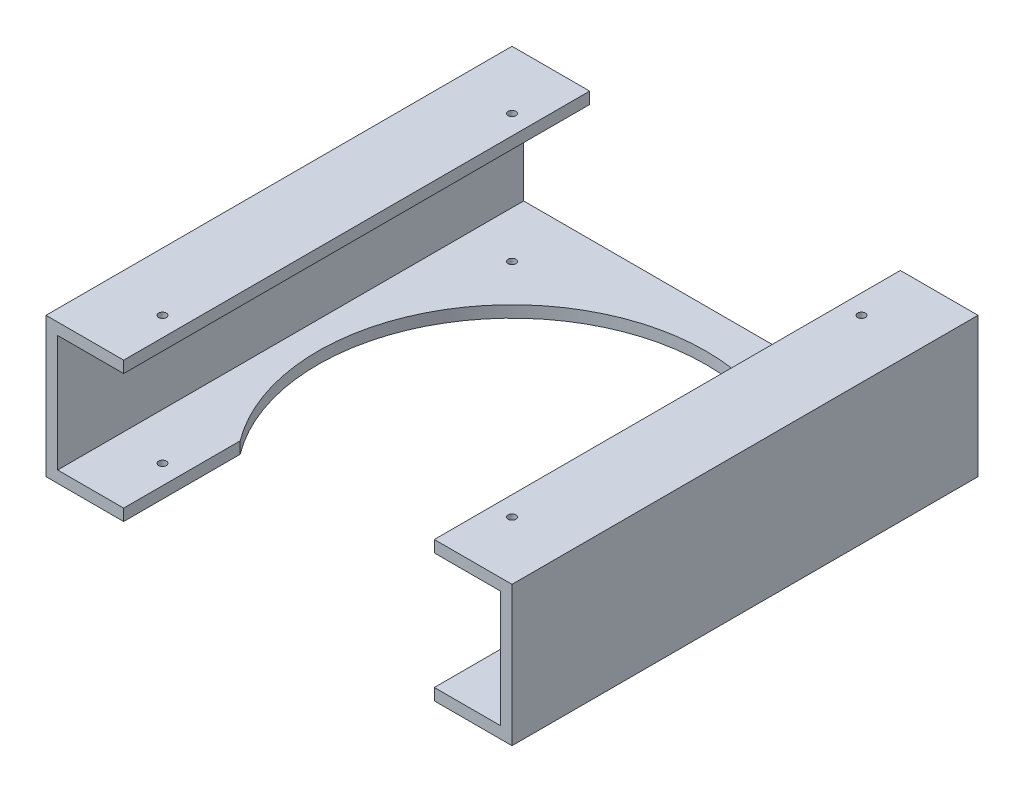
from build123d import *

# Parameters (mm, degrees)
BOSS_EXTRUDE1_DEPTH      = 60
BOSS_EXTRUDE1_DEPTH_BACK = 60
SKETCH1_W                = 120
SKETCH1_H                = 36
SKETCH2_W                = 114
SKETCH2_H                = 30
CUT_EXTRUDE1_DEPTH       = 136.366170072
SKETCH3_W                = 80
SKETCH3_H                = 22.357813814
CUT_EXTRUDE2_DEPTH       = 136.366170072
SKETCH4_R                = 50
CUT_EXTRUDE3_DEPTH       = 92.043945433
SKETCH7_R                = 1
CUT_EXTRUDE4_DEPTH       = 93.173748974
CUT_EXTRUDE6_REACH       = 94.174
SKETCH9_W                = 80
SKETCH9_H                = 60


with BuildPart() as part:
    # Sketch1 → Boss-Extrude1 (new, two sides: drawn at the far end of the back side and taken through both)
    with BuildSketch(Plane.XY.offset(-BOSS_EXTRUDE1_DEPTH_BACK)):
        Rectangle(SKETCH1_W, SKETCH1_H)
    extrude(amount=BOSS_EXTRUDE1_DEPTH + BOSS_EXTRUDE1_DEPTH_BACK)

    # Sketch2 → Cut-Extrude1 (cut, through all)
    with BuildSketch(Plane.XY.offset(60)):
        Rectangle(SKETCH2_W, SKETCH2_H)
    extrude(amount=-CUT_EXTRUDE1_DEPTH, mode=Mode.SUBTRACT)

    # Sketch3 → Cut-Extrude2 (cut, through all)
    with BuildSketch(Plane.XY.offset(60)):
        with Locations((0, 15)):
            Rectangle(SKETCH3_W, SKETCH3_H)
    extrude(amount=-CUT_EXTRUDE2_DEPTH, mode=Mode.SUBTRACT)

    # Sketch4 → Cut-Extrude3 (cut, through all)
    with BuildSketch(Plane(origin=(0, -15, 0), x_dir=(1, 0, 0), z_dir=(0, 1, 0))):
        Circle(SKETCH4_R)
    extrude(amount=-CUT_EXTRUDE3_DEPTH, mode=Mode.SUBTRACT)

    # Sketch7 → Cut-Extrude4 (cut, through all)
    with BuildSketch(Plane(origin=(0, -18, 0), x_dir=(-1, 0, 0), z_dir=(0, -1, 0))):
        with Locations((45, -45)):
            Circle(SKETCH7_R)
        with Locations((-45, -45)):
            Circle(SKETCH7_R)
        with Locations((-45, 45)):
            Circle(SKETCH7_R)
        with Locations((45, 45)):
            Circle(SKETCH7_R)
    extrude(amount=-CUT_EXTRUDE4_DEPTH, mode=Mode.SUBTRACT)

    # Sketch9 → Cut-Extrude6 (cut, up to next)
    with BuildSketch(Plane.XZ.offset(18), mode=Mode.PRIVATE) as cut_extrude6_sk1:
        with Locations((0, 60)):
            Rectangle(SKETCH9_W, SKETCH9_H)
    cut_extrude6_tool1 = extrude(cut_extrude6_sk1.sketch, amount=-CUT_EXTRUDE6_REACH, mode=Mode.PRIVATE) & part.part
    add(cut_extrude6_tool1.solids().sort_by_distance((0, -18, 60))[0], mode=Mode.SUBTRACT)


solid = part.part
